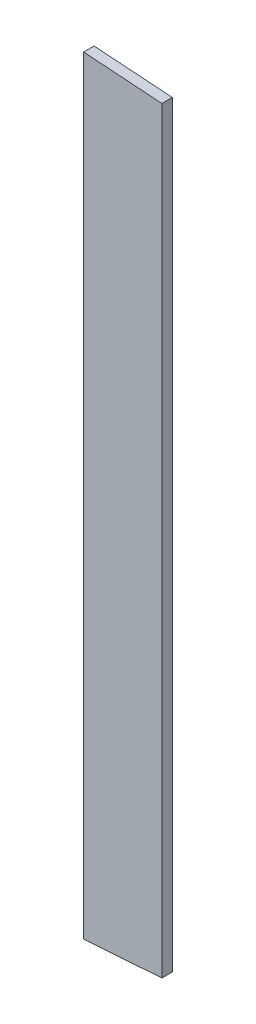
from build123d import *

# Parameters (mm, degrees)
BOSS_EXTRUDE1_DEPTH = 2


with BuildPart() as part:
    # Sketch1 → Boss-Extrude1 (new body)
    with BuildSketch(Plane.XY.offset(2758.549999999)):
        Polygon((-49.769678516, 346.108282384), (-64.769678516, 345.059380205), (-64.769678516, 492.415801833), (-49.769678516, 491.366899654), align=None)
    extrude(amount=BOSS_EXTRUDE1_DEPTH)


solid = part.part
